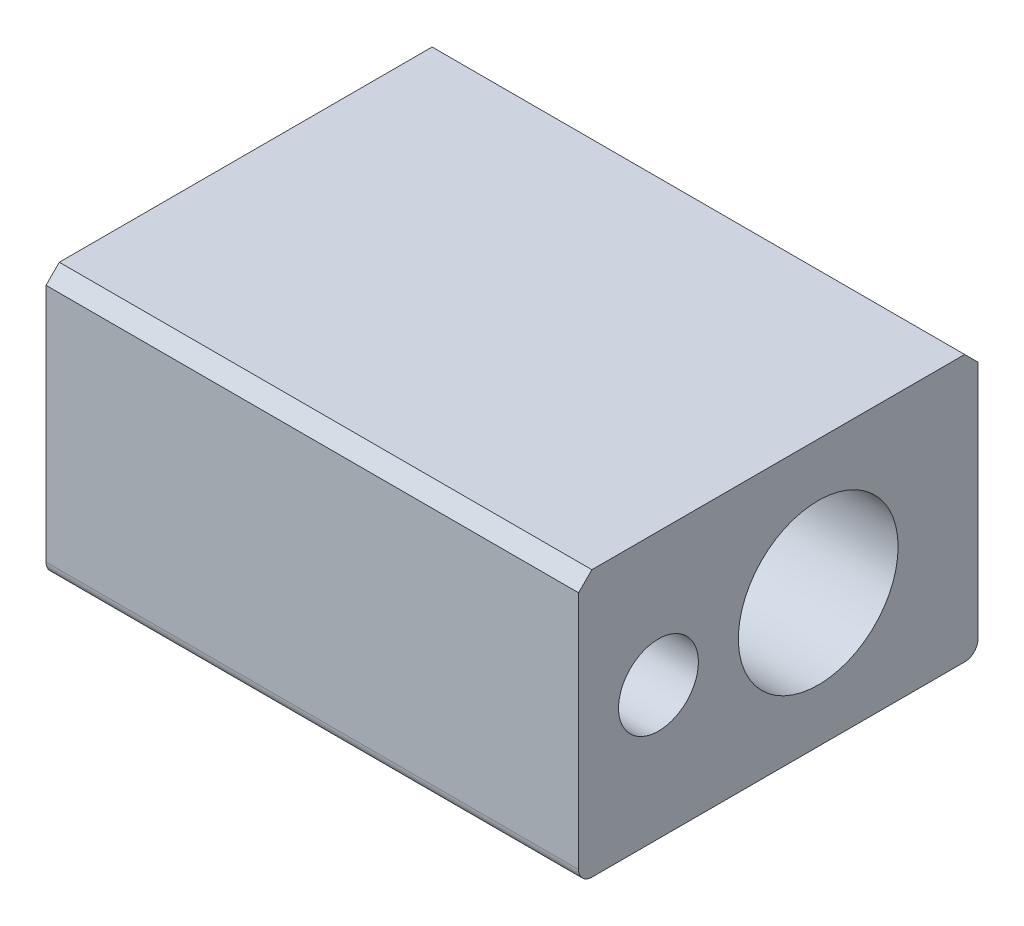
from build123d import *

# Parameters (mm, degrees)
SKETCH1_W           = 50.8
SKETCH1_H           = 76.2
SKETCH1_R           = 15.24
SKETCH1_R_2         = 7.62
BOSS_EXTRUDE1_DEPTH = 101.6
FILLET1_R           = 2.54
CHAMFER1_SIZE       = 2.54


with BuildPart() as part:
    # Sketch1 → Boss-Extrude1 (new body)
    with BuildSketch(Plane.YZ):
        Rectangle(SKETCH1_W, SKETCH1_H)
        with Locations(Location((0, -7.62, 0), (0, 0, 270))):
            Circle(SKETCH1_R, mode=Mode.SUBTRACT)
        with Locations(Location((0, 22.86, 0), (0, 0, 270))):
            Circle(SKETCH1_R_2, mode=Mode.SUBTRACT)
    extrude(amount=BOSS_EXTRUDE1_DEPTH)

    # Fillet1
    fillet1_edges = [part.edges().sort_by_distance(p)[0] for p in [
        (50.8, -25.4, 38.1),
        (50.8, -25.4, -38.1),
    ]]
    fillet(fillet1_edges, radius=FILLET1_R)

    # Chamfer1
    chamfer1_edges = [part.edges().sort_by_distance(p)[0] for p in [
        (50.8, 25.4, 38.1),
        (50.8, 25.4, -38.1),
    ]]
    chamfer(chamfer1_edges, length=CHAMFER1_SIZE)


solid = part.part
